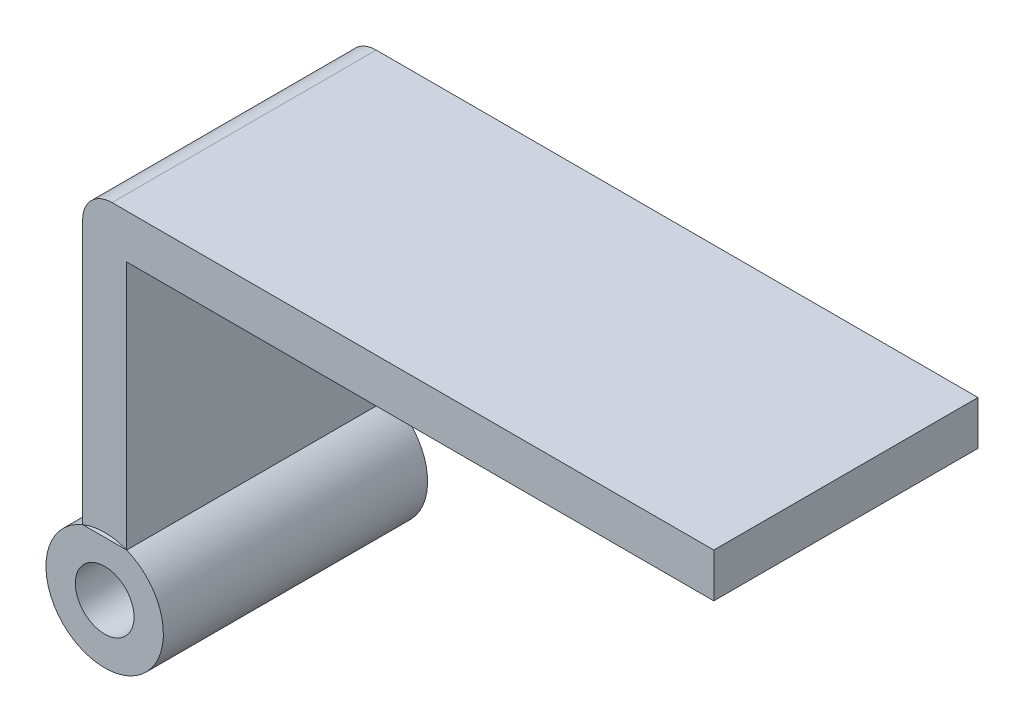
from build123d import *

# Parameters (mm, degrees)
BOSS_EXTRUDE1_DEPTH   = 18
SKETCH1_R             = 2
BOSS_EXTRUDE1_2_DEPTH = 18
FILLET1_R             = 2


with BuildPart() as part:
    # Sketch1 → Boss-Extrude1 (new body)
    with BuildSketch(Plane.XY):
        with BuildLine():
            Line((-1.5, 50.396439737), (-1.5, 30.396439737))
            ThreePointArc((-1.5, 30.396439737), (0, 30.688340494), (1.5, 30.396439737))
            Line((1.5, 30.396439737), (1.5, 47.396439737))
            Line((1.5, 47.396439737), (41.5, 47.396439737))
            Line((41.5, 47.396439737), (41.5, 50.396439737))
            Line((41.5, 50.396439737), (1.5, 50.396439737))
            Line((1.5, 50.396439737), (-1.5, 50.396439737))
        make_face()
    extrude(amount=BOSS_EXTRUDE1_DEPTH)

    # Fillet1
    fillet1_edges = [part.edges().sort_by_distance(p)[0] for p in [
        (-1.5, 50.396439737, 9),
    ]]
    fillet(fillet1_edges, radius=FILLET1_R)


with BuildPart() as body_2:
    # Sketch1 → Boss-Extrude1 2 (new body)
    with BuildSketch(Plane.XY):
        with BuildLine():
            Line((1.5, 30.396439737), (-1.5, 30.396439737))
            ThreePointArc((-1.5, 30.396439737), (-2.236067977, 23.371715703), (4, 26.688340494))
            ThreePointArc((4, 26.688340494), (3.31662479, 28.924408471), (1.5, 30.396439737))
        make_face()
        with Locations((0, 26.688340494)):
            Circle(SKETCH1_R, mode=Mode.SUBTRACT)
    extrude(amount=BOSS_EXTRUDE1_2_DEPTH)


solid = Compound([part.part, body_2.part])
